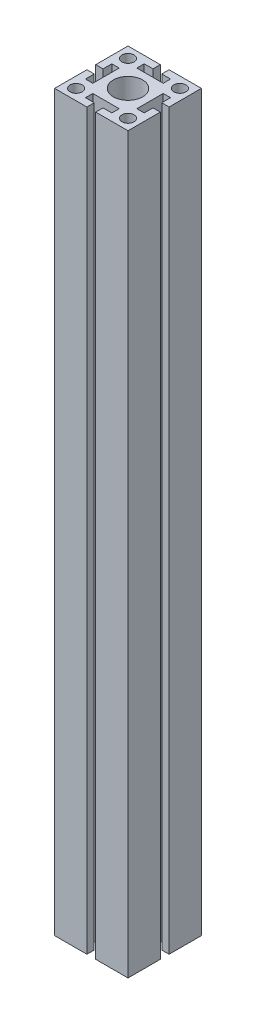
from build123d import *

# Parameters (mm, degrees)
SKETCH1_R           = 10
SKETCH1_R_2         = 4.138691164
BOSS_EXTRUDE1_DEPTH = 500


with BuildPart() as part:
    # Sketch1 → Boss-Extrude1 (new body)
    with BuildSketch(Plane(origin=(0, 0, 0), x_dir=(1, 0, 0), z_dir=(0, 1, 0))):
        Polygon((-25, -3), (-25, -25), (-3, -25), (-3, -20), (-9, -20), (-9, -15), (9, -15), (9, -20), (3, -20), (3, -25), (25, -25), (25, -3), (20, -3), (20, -9), (15, -9), (15, 9), (20, 9), (20, 3), (25, 3), (25, 25), (3, 25), (3, 20), (9, 20), (9, 15), (-9, 15), (-9, 20), (-3, 20), (-3, 25), (-25, 25), (-25, 3), (-20, 3), (-20, 9), (-15, 9), (-15, -9), (-20, -9), (-20, -3), align=None)
        with Locations(Location((0, 0, 0), (0, 0, 270))):
            Circle(SKETCH1_R, mode=Mode.SUBTRACT)
        with Locations(Location((-17.67766953, 17.67766953, 0), (0, 0, 270))):
            Circle(SKETCH1_R_2, mode=Mode.SUBTRACT)
        with Locations(Location((17.67766953, 17.67766953, 0), (0, 0, 270))):
            Circle(SKETCH1_R_2, mode=Mode.SUBTRACT)
        with Locations(Location((17.67766953, -17.67766953, 0), (0, 0, 270))):
            Circle(SKETCH1_R_2, mode=Mode.SUBTRACT)
        with Locations(Location((-17.67766953, -17.67766953, 0), (0, 0, 270))):
            Circle(SKETCH1_R_2, mode=Mode.SUBTRACT)
    extrude(amount=BOSS_EXTRUDE1_DEPTH)


solid = part.part
